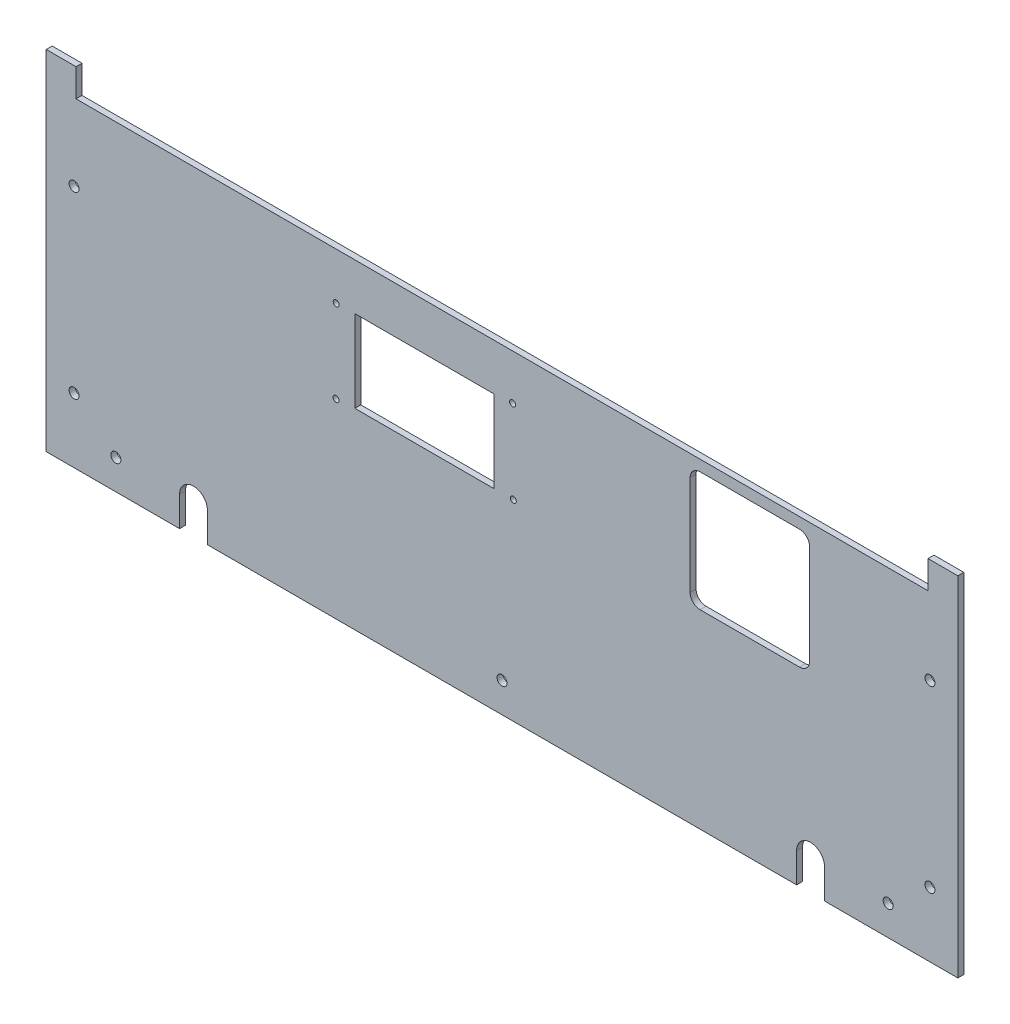
from build123d import *

# Parameters (mm, degrees)
SKETCH1_W                         = 458
SKETCH1_H                         = 245
BOSS_EXTRUDE1_DEPTH               = 3
CUT_EXTRUDE1_DEPTH                = 260.723410574
SKETCH3_R                         = 2.5
CUT_EXTRUDE2_DEPTH                = 260.723410574
SKETCH4_R                         = 11.5
CUT_EXTRUDE3_DEPTH                = 260.723410574
SKETCH5_W                         = 428
SKETCH5_H                         = 29
CUT_EXTRUDE4_DEPTH                = 260.723410574
SKETCH8_R                         = 1.5
SKETCH8_W                         = 69.9
SKETCH8_H                         = 41.2
CUT_EXTRUDE5_DEPTH                = 260.723410574
SKETCH9_W                         = 458
SKETCH9_H                         = 70
CUT_EXTRUDE6_DEPTH                = 10
CUT_SWITCHRUBBER_60X60_DEPTH      = 260.723410574
CUT_SWITCHRUBBER_60X60_DEPTH_BACK = 260.723410574


with BuildPart() as part:
    # Sketch1 → Boss-Extrude1 (new body)
    with BuildSketch(Plane.XY):
        Rectangle(SKETCH1_W, SKETCH1_H)
    extrude(amount=BOSS_EXTRUDE1_DEPTH)

    # Sketch2 → Cut-Extrude1 (cut, through all)
    with BuildSketch(Plane.XY.offset(3)):
        with BuildLine():
            Line((-148, -107.5), (-148, -122.5))
            ThreePointArc((-148, -122.5), (-155, -129.5), (-162, -122.5))
            Line((-162, -122.5), (-162, -107.5))
            ThreePointArc((-162, -107.5), (-155, -100.5), (-148, -107.5))
        make_face()
        with BuildLine():
            Line((162, -107.5), (162, -122.5))
            ThreePointArc((162, -122.5), (155, -129.5), (148, -122.5))
            Line((148, -122.5), (148, -107.5))
            ThreePointArc((148, -107.5), (155, -100.5), (162, -107.5))
        make_face()
    extrude(amount=-CUT_EXTRUDE1_DEPTH, mode=Mode.SUBTRACT)

    # Sketch3 → Cut-Extrude2 (cut, through all)
    with BuildSketch(Plane.XY.offset(3)):
        with Locations((-194, 112.5)):
            Circle(SKETCH3_R)
        with Locations((-194, -107.5)):
            Circle(SKETCH3_R)
        with Locations((194, -107.5)):
            Circle(SKETCH3_R)
        with Locations((194, 112.5)):
            Circle(SKETCH3_R)
        with Locations((-215, 0)):
            Circle(SKETCH3_R)
        with Locations((-215, -90)):
            Circle(SKETCH3_R)
        with Locations((-215, 90)):
            Circle(SKETCH3_R)
        with Locations((215, 0)):
            Circle(SKETCH3_R)
        with Locations((215, -90)):
            Circle(SKETCH3_R)
        with Locations((215, 90)):
            Circle(SKETCH3_R)
        with Locations((0, 112.5)):
            Circle(SKETCH3_R)
        with Locations((0, -107.5)):
            Circle(SKETCH3_R)
    extrude(amount=-CUT_EXTRUDE2_DEPTH, mode=Mode.SUBTRACT)

    # Sketch4 → Cut-Extrude3 (cut, through all)
    with BuildSketch(Plane.XY.offset(3)):
        with Locations((-39, 91)):
            Circle(SKETCH4_R)
        with Locations((39, 91)):
            Circle(SKETCH4_R)
    extrude(amount=-CUT_EXTRUDE3_DEPTH, mode=Mode.SUBTRACT)

    # Sketch5 → Cut-Extrude4 (cut, through all)
    with BuildSketch(Plane.XY.offset(3)):
        with Locations((0, 53)):
            Rectangle(SKETCH5_W, SKETCH5_H)
    extrude(amount=-CUT_EXTRUDE4_DEPTH, mode=Mode.SUBTRACT)

    # Sketch8 → Cut-Extrude5 (cut, through all)
    with BuildSketch(Plane.XY.offset(3)):
        with Locations((5.296172264, 15.703565509)):
            Circle(SKETCH8_R)
        with Locations((5.679687501, -26.054673392)):
            Circle(SKETCH8_R)
        with Locations((-83.3, 14.88)):
            Circle(SKETCH8_R)
        with Locations((-83.367997673, -26.737946691)):
            Circle(SKETCH8_R)
        with Locations((-39, -5.5)):
            Rectangle(SKETCH8_W, SKETCH8_H)
    extrude(amount=-CUT_EXTRUDE5_DEPTH, mode=Mode.SUBTRACT)

    # Sketch9 → Cut-Extrude6 (cut)
    with BuildSketch(Plane.XY.offset(3)):
        with Locations((0, 87.5)):
            Rectangle(SKETCH9_W, SKETCH9_H)
    extrude(amount=-CUT_EXTRUDE6_DEPTH, mode=Mode.SUBTRACT)

    # Sketch11 → Cut_SwitchRubber_60x60 (cut, two sides: drawn at the far end of the back side and taken through both)
    with BuildSketch(Plane.XY.offset(-CUT_SWITCHRUBBER_60X60_DEPTH_BACK)):
        with BuildLine():
            Line((99.5, -27), (149.5, -27))
            ThreePointArc((149.5, -27), (153.035533906, -25.535533906), (154.5, -22))
            Line((154.5, -22), (154.5, 28))
            ThreePointArc((154.5, 28), (153.035533906, 31.535533906), (149.5, 33))
            Line((149.5, 33), (99.5, 33))
            ThreePointArc((99.5, 33), (95.964466094, 31.535533906), (94.5, 28))
            Line((94.5, 28), (94.5, -22))
            ThreePointArc((94.5, -22), (95.964466094, -25.535533906), (99.5, -27))
        make_face()
    extrude(amount=CUT_SWITCHRUBBER_60X60_DEPTH + CUT_SWITCHRUBBER_60X60_DEPTH_BACK, mode=Mode.SUBTRACT)


solid = part.part
